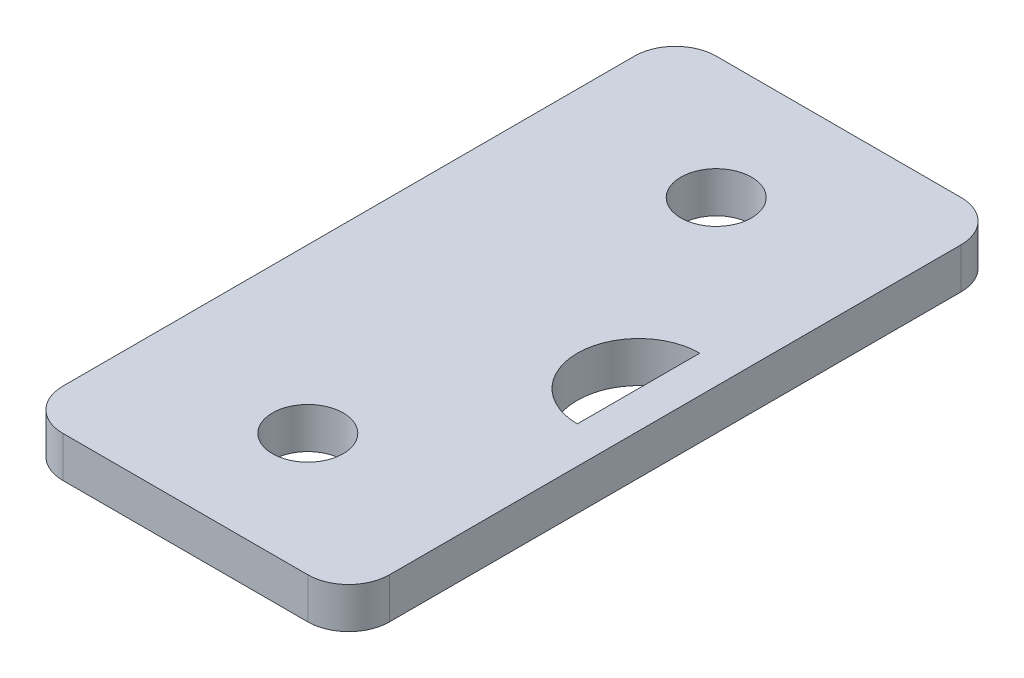
from build123d import *

# Parameters (mm, degrees)
SKETCH1_W            = 25.4
SKETCH1_H            = 50.8
BOSS_EXTRUDE1_DEPTH  = 3.175
CUT_EXTRUDE2_DEPTH   = 29.575
M5_CLEARANCE_HOLE1_D = 5.5
FILLET1_R            = 3.175


with BuildPart() as part:
    # Sketch1 → Boss-Extrude1 (new body)
    with BuildSketch(Plane(origin=(0, 0, 0), x_dir=(1, 0, 0), z_dir=(0, 1, 0))):
        Rectangle(SKETCH1_W, SKETCH1_H)
    extrude(amount=BOSS_EXTRUDE1_DEPTH)

    # Sketch8 → Cut-Extrude2 (cut, through all)
    with BuildSketch(Plane.XZ):
        with BuildLine():
            Line((9.8425, 4.7625), (9.8425, -4.7625))
            ThreePointArc((9.8425, -4.7625), (5.08, 0), (9.8425, 4.7625))
        make_face()
    extrude(amount=-CUT_EXTRUDE2_DEPTH, mode=Mode.SUBTRACT)

    # M5 Clearance Hole1 (through all)
    with Locations(Plane(origin=(0, 0, 0), x_dir=(-1, 0, 0), z_dir=(0, -1, 0))):
        with Locations((0, 15.875), (0, -15.875)):
            Hole(M5_CLEARANCE_HOLE1_D / 2)

    # Fillet1
    fillet1_edges = [part.edges().sort_by_distance(p)[0] for p in [
        (12.7, 1.5875, 25.4),
        (-12.7, 1.5875, 25.4),
        (-12.7, 1.5875, -25.4),
        (12.7, 1.5875, -25.4),
    ]]
    fillet(fillet1_edges, radius=FILLET1_R)


solid = part.part
